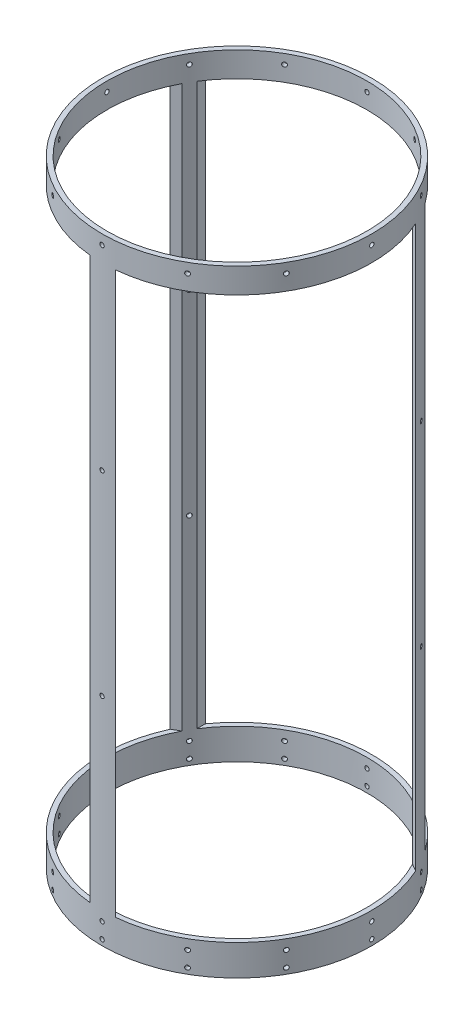
from build123d import *

# Parameters (mm, degrees)
SKETCH1_R               = 88.9
SKETCH1_R_2             = 85.725
BOSS_EXTRUDE1_DEPTH     = 203.2
CUT_EXTRUDE1_REACH      = 240.949
CUT_EXTRUDE1_END_RADIUS = 88.9
SKETCH2_W               = 144.78
SKETCH2_H               = 369.57
CIRPATTERN1_COUNT       = 3
SKETCH3_R               = 1.4351
CUT_EXTRUDE2_DEPTH      = 15.24
CIRPATTERN2_COUNT       = 12
SKETCH4_R               = 1.4351
CUT_EXTRUDE3_DEPTH      = 15.24
CIRPATTERN3_COUNT       = 12
SKETCH5_R               = 1.4351
CUT_EXTRUDE4_DEPTH      = 35.56
CIRPATTERN4_COUNT       = 3


with BuildPart() as part:
    # Sketch1 → Boss-Extrude1 (new, symmetric)
    with BuildSketch(Plane(origin=(0, 0, 0), x_dir=(1, 0, 0), z_dir=(0, 1, 0))):
        with Locations(Location((0, 0, 0), (0, 0, 270))):
            Circle(SKETCH1_R)
        with Locations(Location((0, 0, 0), (0, 0, 270))):
            Circle(SKETCH1_R_2, mode=Mode.SUBTRACT)
    extrude(amount=BOSS_EXTRUDE1_DEPTH, both=True)

    # Cut-Extrude1: up to this cylinder (the profile starts inside it)
    cut_extrude1_end = Plane(origin=(0, 1.905, 0), z_dir=(0, -1, 0)) * Cylinder(CUT_EXTRUDE1_END_RADIUS, 660.698, mode=Mode.PRIVATE)
    # Sketch2 → Cut-Extrude1 (cut, up to the surface)
    with BuildSketch(Plane.XY, mode=Mode.PRIVATE) as cut_extrude1_sk1:
        with Locations((0, 1.905)):
            Rectangle(SKETCH2_W, SKETCH2_H)
    cut_extrude1_tool1 = extrude(cut_extrude1_sk1.sketch, amount=-CUT_EXTRUDE1_REACH, mode=Mode.PRIVATE) & cut_extrude1_end
    cut_extrude1 = cut_extrude1_tool1.solids().sort_by_distance((0, 1.905, 0))[0]
    add(cut_extrude1, mode=Mode.SUBTRACT)

    # CirPattern1: Cut-Extrude1 ×3 about axis
    cirpattern1_axis = Axis((0, 0, 0), (0, 1, 0))
    for i in range(1, CIRPATTERN1_COUNT):
        add(cut_extrude1.rotate(cirpattern1_axis, i * 360 / CIRPATTERN1_COUNT), mode=Mode.SUBTRACT)

    # Sketch3 → Cut-Extrude2 (cut)
    with BuildSketch(Plane(origin=(88.9, 0, 0), x_dir=(0, 0, -1), z_dir=(1, 0, 0))):
        with Locations((0, -199.39)):
            Circle(SKETCH3_R)
        with Locations((0, -189.23)):
            Circle(SKETCH3_R)
    cut_extrude2 = extrude(amount=-CUT_EXTRUDE2_DEPTH, mode=Mode.SUBTRACT)

    # CirPattern2: Cut-Extrude2 ×12 about axis
    cirpattern2_axis = Axis((0, 203.2, 0), (0, -1, 0))
    for i in range(1, CIRPATTERN2_COUNT):
        add(cut_extrude2.rotate(cirpattern2_axis, i * 360 / CIRPATTERN2_COUNT), mode=Mode.SUBTRACT)

    # Sketch4 → Cut-Extrude3 (cut)
    with BuildSketch(Plane(origin=(88.9, 0, 0), x_dir=(0, 0, -1), z_dir=(1, 0, 0))):
        with Locations((0, 196.85)):
            Circle(SKETCH4_R)
    cut_extrude3 = extrude(amount=-CUT_EXTRUDE3_DEPTH, mode=Mode.SUBTRACT)

    # CirPattern3: Cut-Extrude3 ×12 about axis
    cirpattern3_axis = Axis((0, 203.2, 0), (0, -1, 0))
    for i in range(1, CIRPATTERN3_COUNT):
        add(cut_extrude3.rotate(cirpattern3_axis, i * 360 / CIRPATTERN3_COUNT), mode=Mode.SUBTRACT)

    # Sketch5 → Cut-Extrude4 (cut)
    with BuildSketch(Plane.XY.offset(88.9)):
        with Locations((0, 68.1736)):
            Circle(SKETCH5_R)
        with Locations((0, -60.5536)):
            Circle(SKETCH5_R)
    cut_extrude4 = extrude(amount=-CUT_EXTRUDE4_DEPTH, mode=Mode.SUBTRACT)

    # CirPattern4: Cut-Extrude4 ×3 about axis
    cirpattern4_axis = Axis((0, 203.2, 0), (0, -1, 0))
    for i in range(1, CIRPATTERN4_COUNT):
        add(cut_extrude4.rotate(cirpattern4_axis, i * 360 / CIRPATTERN4_COUNT), mode=Mode.SUBTRACT)


solid = part.part
